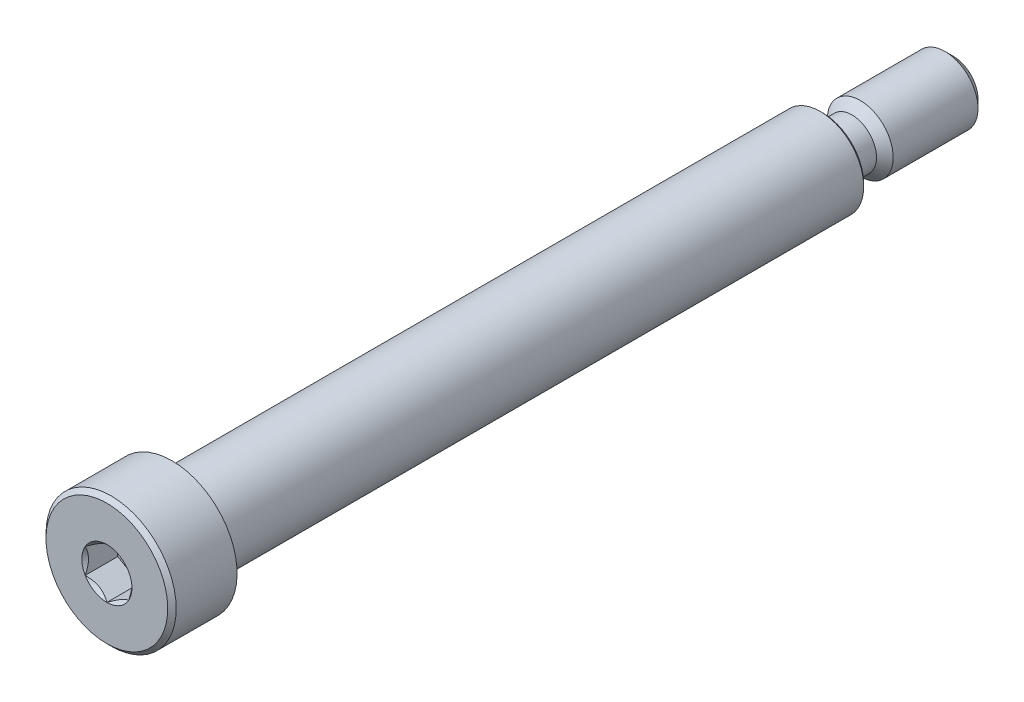
from build123d import *

# Parameters (mm, degrees)
CHAMFER1_SIZE      = 0.60325
CHAMFER2_SIZE      = 0.3095625
CHAMFER3_SIZE      = 0.2032
CUT_EXTRUDE2_DEPTH = 2.38125


with BuildPart() as part:
    # Sketch1 → Revolve1 (revolve)
    with BuildSketch(Plane(origin=(0, 0, 0), x_dir=(0, 0, -1), z_dir=(1, 0, 0))):
        Polygon((0, 4.7625), (4.7625, 4.7625), (4.7625, 3.175), (52.3875, 3.175), (52.3875, 2.413), (61.9125, 2.413), (61.9125, 0), (0, 0), align=None)
    revolve(axis=Axis((0, 0, -61.9125), (0, 0, 1)))

    # Sketch5 → Cut-Revolve1 (revolve, cut)
    with BuildSketch(Plane(origin=(0, 0, 0), x_dir=(0, 0, -1), z_dir=(1, 0, 0))):
        with BuildLine():
            Line((52.3875, 3.175), (55.8673, 3.175))
            Line((55.8673, 3.175), (54.4957, 1.8034))
            Line((54.4957, 1.8034), (52.9971, 1.8034))
            ThreePointArc((52.9971, 1.8034), (52.566047706, 1.981947706), (52.3875, 2.413))
            Line((52.3875, 2.413), (52.3875, 3.175))
        make_face()
    revolve(axis=Axis((0, 0, -61.9125), (0, 0, 1)), mode=Mode.SUBTRACT)

    # Chamfer1
    chamfer1_edges = [part.edges().sort_by_distance(p)[0] for p in [
        (0, -2.413, -61.9125),
    ]]
    chamfer(chamfer1_edges, length=CHAMFER1_SIZE)

    # Chamfer2
    chamfer2_edges = [part.edges().sort_by_distance(p)[0] for p in [
        (0, -4.7625, 0),
    ]]
    chamfer(chamfer2_edges, length=CHAMFER2_SIZE)

    # Chamfer3
    chamfer3_edges = [part.edges().sort_by_distance(p)[0] for p in [
        (0, -3.175, -52.3875),
    ]]
    chamfer(chamfer3_edges, length=CHAMFER3_SIZE)

    # Sketch8 → Cut-Extrude2 (cut)
    with BuildSketch(Plane.XY):
        Polygon((1.5875, 0.916543552), (0, 1.833087105), (-1.5875, 0.916543552), (-1.5875, -0.916543552), (0, -1.833087105), (1.5875, -0.916543552), align=None)
    extrude(amount=-CUT_EXTRUDE2_DEPTH, mode=Mode.SUBTRACT)

    # Cut-Extrude4 cone 1 section (through the dimple's axis) → Cut-Extrude4 (revolve, cut)
    with BuildSketch(Plane(origin=(0, 0, 0), x_dir=(0, -1, 0), z_dir=(1, 0, 0))):
        Polygon((0, 0), (1.833087105, 0), (0, 1.833087105), align=None)
    revolve(axis=Axis((0, 0, 0), (0, 0, -1)), mode=Mode.SUBTRACT)


solid = part.part
